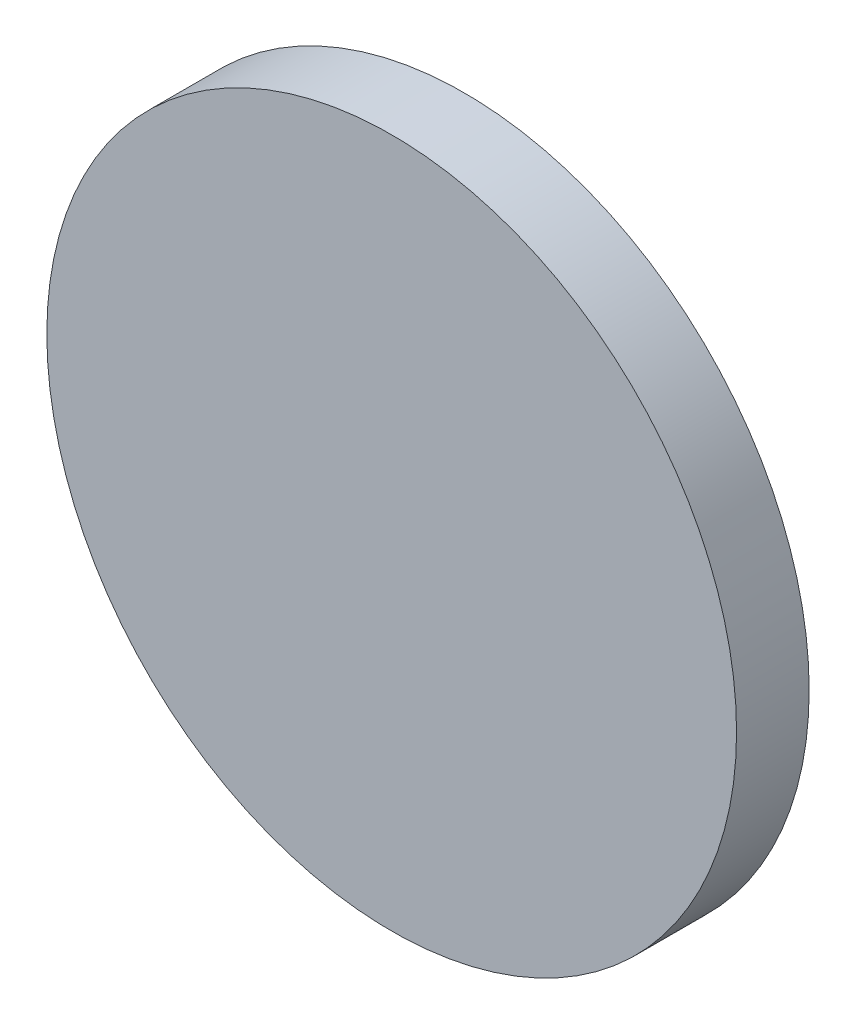
from build123d import *

# Parameters (mm, degrees)
SKETCH1_R           = 30.1625
BOSS_EXTRUDE1_DEPTH = 3.175


with BuildPart() as part:
    # Sketch1 → Boss-Extrude1 (new, symmetric)
    with BuildSketch(Plane.XY):
        Circle(SKETCH1_R)
    extrude(amount=BOSS_EXTRUDE1_DEPTH, both=True)


solid = part.part
